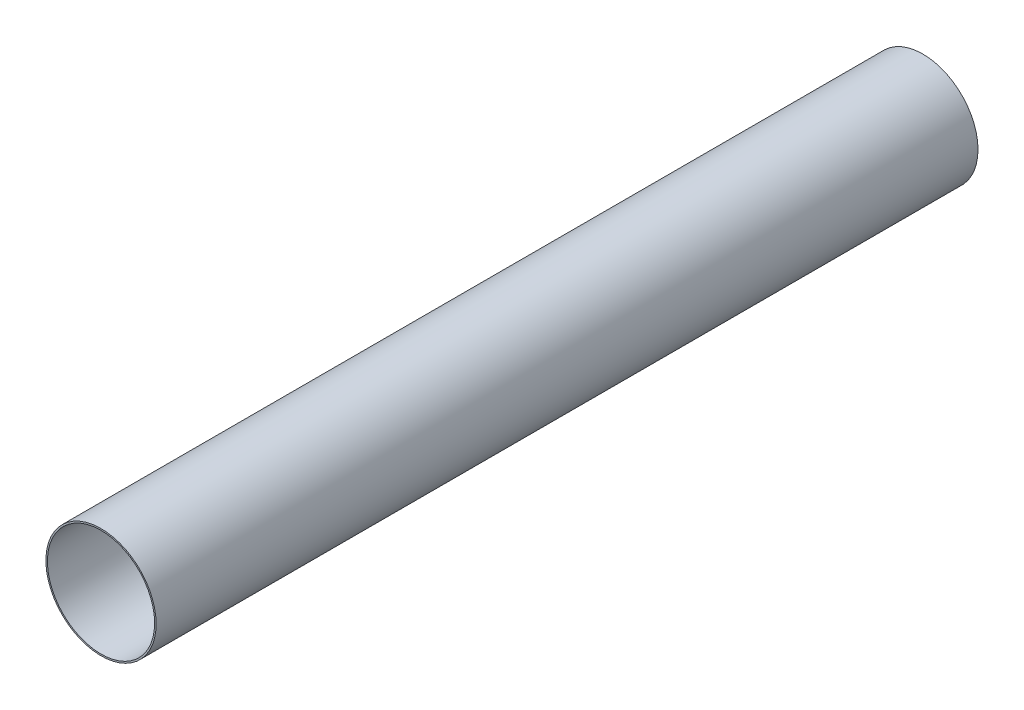
from build123d import *

# Parameters (mm, degrees)
ESQUISSE2_R        = 78.359
ESQUISSE2_R_2      = 76.2
BOSS_EXTRU_1_DEPTH = 1168.4


with BuildPart() as part:
    # Esquisse2 → Boss.-Extru.1 (new body)
    with BuildSketch(Plane.XY):
        Circle(ESQUISSE2_R)
        Circle(ESQUISSE2_R_2, mode=Mode.SUBTRACT)
    extrude(amount=BOSS_EXTRU_1_DEPTH)


solid = part.part
